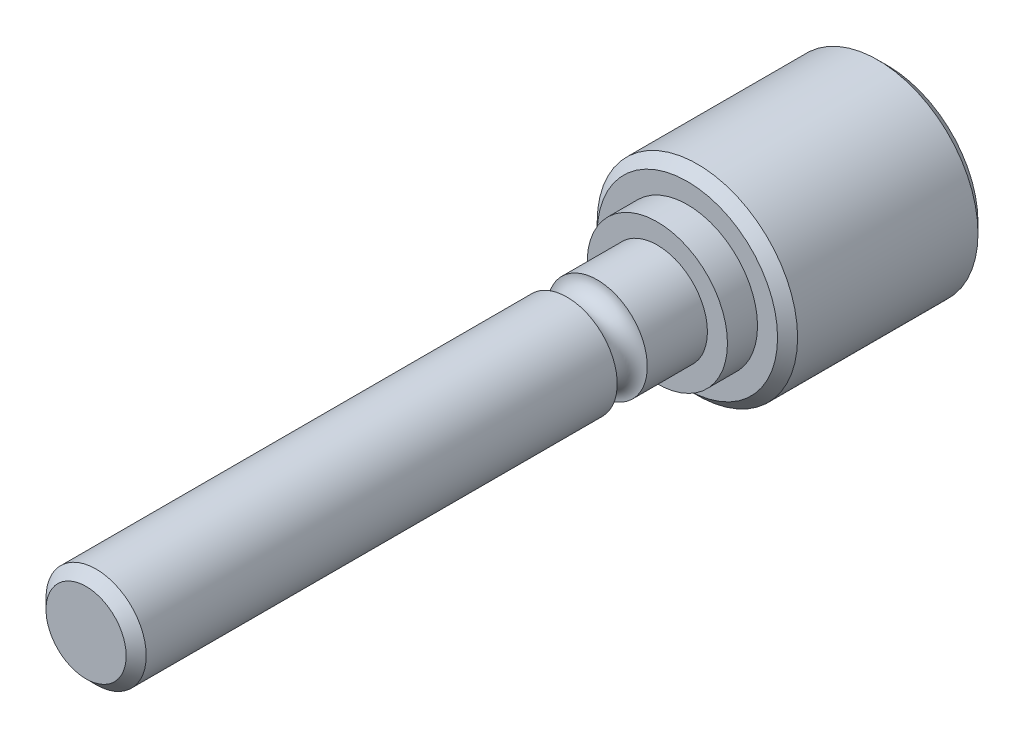
from build123d import *

# Parameters (mm, degrees)
ESBO_O1_R                = 10
RESSALTO_EXTRUS_O1_DEPTH = 20
ESBO_O2_R                = 7
RESSALTO_EXTRUS_O2_DEPTH = 3
ESBO_O3_R                = 5
RESSALTO_EXTRUS_O3_DEPTH = 57
CHANFRO1_SIZE            = 1
CHANFRO2_SIZE            = 1
CHANFRO3_SIZE            = 1
ESBO_O5_R                = 1.5


with BuildPart() as part:
    # Esboço1 → Ressalto-extrusão1 (new body)
    with BuildSketch(Plane.XY):
        Circle(ESBO_O1_R)
    extrude(amount=RESSALTO_EXTRUS_O1_DEPTH)

    # Esboço2 → Ressalto-extrusão2 (add)
    with BuildSketch(Plane.XY.offset(20)):
        Circle(ESBO_O2_R)
    extrude(amount=RESSALTO_EXTRUS_O2_DEPTH)

    # Esboço3 → Ressalto-extrusão3 (add)
    with BuildSketch(Plane.XY.offset(23)):
        with Locations(Location((0, 0, 0), (0, 0, 180))):
            Circle(ESBO_O3_R)
    extrude(amount=RESSALTO_EXTRUS_O3_DEPTH)

    # Chanfro1
    chanfro1_edges = [part.edges().sort_by_distance(p)[0] for p in [
        (-10, 0, 0),
    ]]
    chamfer(chanfro1_edges, length=CHANFRO1_SIZE)

    # Chanfro2
    chanfro2_edges = [part.edges().sort_by_distance(p)[0] for p in [
        (-10, 0, 20),
    ]]
    chamfer(chanfro2_edges, length=CHANFRO2_SIZE)

    # Chanfro3
    chanfro3_edges = [part.edges().sort_by_distance(p)[0] for p in [
        (5, 0, 80),
    ]]
    chamfer(chanfro3_edges, length=CHANFRO3_SIZE)

    # Varredura de corte1: sweep along a path in Esboço7
    with BuildLine(Plane.XY.offset(30.5)) as varredura_de_corte1_path:
        CenterArc((0, 0), 5, 0, 360)
    # Esboço5 → Varredura de corte1 (sweep, cut)
    with BuildSketch(Plane(origin=(0, 0, 0), x_dir=(1, 0, 0), z_dir=(0, 1, 0))):
        with Locations((-5, -30.5)):
            Circle(ESBO_O5_R)
    sweep(path=varredura_de_corte1_path.line, mode=Mode.SUBTRACT)


solid = part.part
